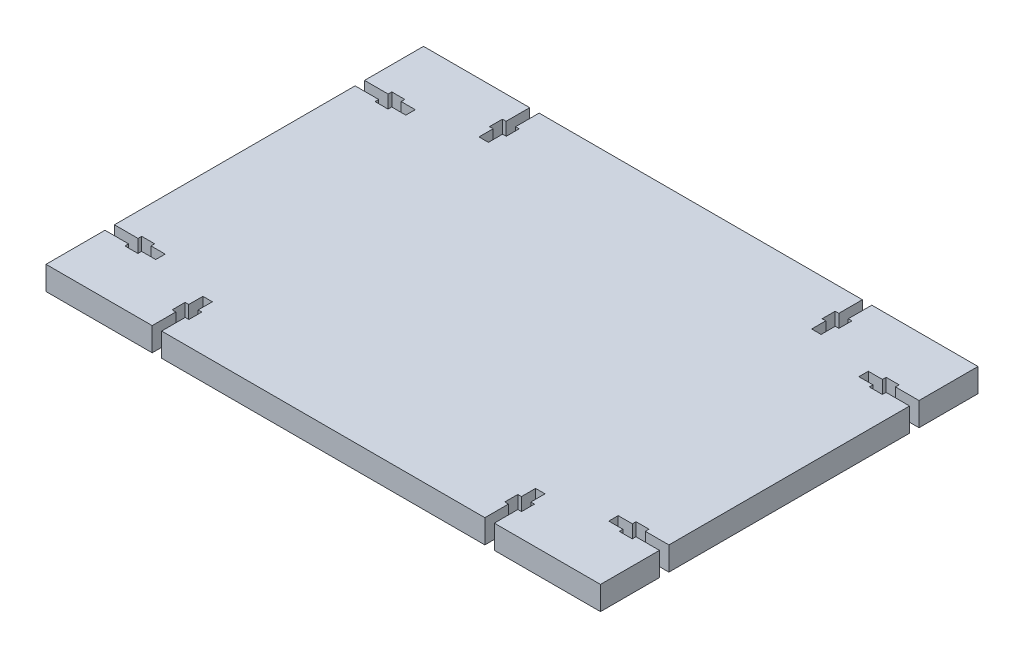
from build123d import *

# Parameters (mm, degrees)
SKETCH1_W               = 235
SKETCH1_H               = 10
BOSS_EXTRUDE1_DEPTH     = 160
ENL_V_MAT_EXTRU_2_DEPTH = 10
ENL_V_MAT_EXTRU_3_DEPTH = 10


with BuildPart() as part:
    # Sketch1 → Boss-Extrude1 (new body)
    with BuildSketch(Plane.XY):
        with Locations((117.5, 5)):
            Rectangle(SKETCH1_W, SKETCH1_H)
    extrude(amount=BOSS_EXTRUDE1_DEPTH)

    # Esquisse2 → Enlèv. mat.-Extru.2 (cut)
    with BuildSketch(Plane.XZ):
        Polygon((0, 135), (10, 135), (10, 136.55), (15.5, 136.55), (15.5, 135), (21.5, 135), (21.5, 131), (15.5, 131), (15.5, 129.45), (10, 129.45), (10, 131), (0, 131), align=None)
        Polygon((0, 29), (10, 29), (10, 30.55), (15.5, 30.55), (15.5, 29), (21.5, 29), (21.5, 25), (15.5, 25), (15.5, 23.45), (10, 23.45), (10, 25), (0, 25), align=None)
        Polygon((235, 25), (225, 25), (225, 23.45), (219.5, 23.45), (219.5, 25), (213.5, 25), (213.5, 29), (219.5, 29), (219.5, 30.55), (225, 30.55), (225, 29), (235, 29), align=None)
        Polygon((235, 131), (225, 131), (225, 129.45), (219.5, 129.45), (219.5, 131), (213.5, 131), (213.5, 135), (219.5, 135), (219.5, 136.55), (225, 136.55), (225, 135), (235, 135), align=None)
    extrude(amount=-ENL_V_MAT_EXTRU_2_DEPTH, mode=Mode.SUBTRACT)

    # Esquisse3 → Enlèv. mat.-Extru.3 (cut)
    with BuildSketch(Plane.XZ):
        Polygon((45, 160), (45, 150), (43.45, 150), (43.45, 144.5), (45, 144.5), (45, 138.5), (49, 138.5), (49, 144.5), (50.55, 144.5), (50.55, 150), (49, 150), (49, 160), align=None)
        Polygon((186, 160), (186, 150), (184.45, 150), (184.45, 144.5), (186, 144.5), (186, 138.5), (190, 138.5), (190, 144.5), (191.55, 144.5), (191.55, 150), (190, 150), (190, 160), align=None)
        Polygon((190, 0), (190, 10), (191.55, 10), (191.55, 15.5), (190, 15.5), (190, 21.5), (186, 21.5), (186, 15.5), (184.45, 15.5), (184.45, 10), (186, 10), (186, 0), align=None)
        Polygon((49, 0), (49, 10), (50.55, 10), (50.55, 15.5), (49, 15.5), (49, 21.5), (45, 21.5), (45, 15.5), (43.45, 15.5), (43.45, 10), (45, 10), (45, 0), align=None)
    extrude(amount=-ENL_V_MAT_EXTRU_3_DEPTH, mode=Mode.SUBTRACT)


solid = part.part
